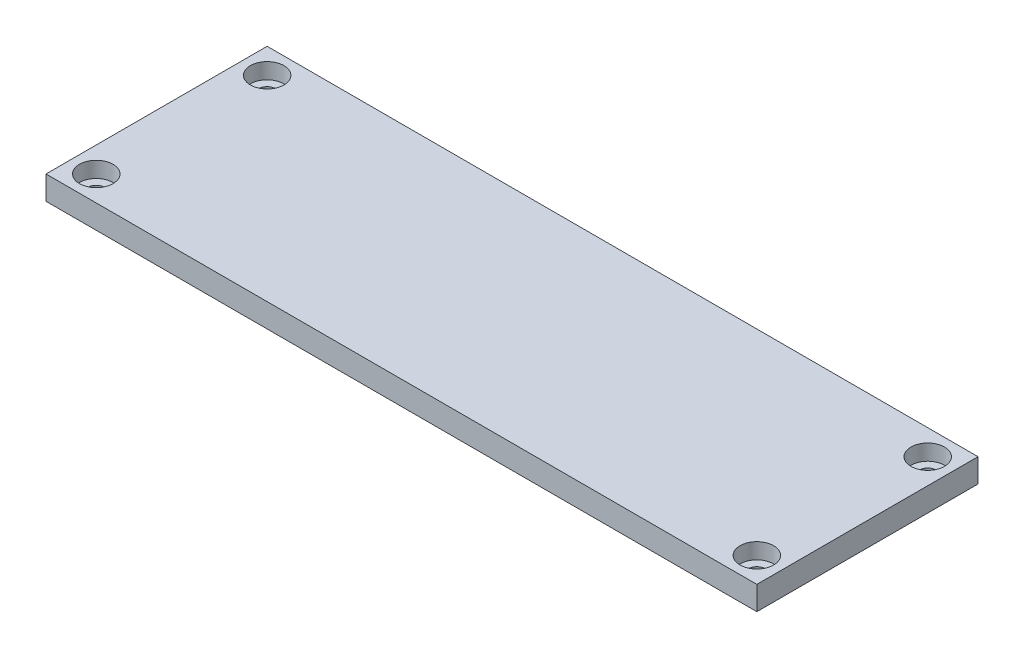
from build123d import *

# Parameters (mm, degrees)
SKETCH2_W           = 90
SKETCH2_H           = 28
BOSS_EXTRUDE1_DEPTH = 3
SKETCH3_R           = 2.125
SKETCH3_R_2         = 1.075
CUT_EXTRUDE1_DEPTH  = 2
SKETCH5_R           = 1.075
CUT_EXTRUDE3_DEPTH  = 4


with BuildPart() as part:
    # Sketch2 → Boss-Extrude1 (new body)
    with BuildSketch(Plane(origin=(0, 0, 0), x_dir=(1, 0, 0), z_dir=(0, 1, 0))):
        with Locations((10.225806452, 5.983870968)):
            Rectangle(SKETCH2_W, SKETCH2_H)
    extrude(amount=BOSS_EXTRUDE1_DEPTH)

    # Sketch3 → Cut-Extrude1 (cut)
    # profile 1 of 4: a face of its own
    with BuildSketch(Plane(origin=(0, 3, 0), x_dir=(1, 0, 0), z_dir=(0, 1, 0))):
        with Locations(Location((-31.592213033, 16.801890452, 0), (0, 0, 270))):
            Circle(SKETCH3_R)
        with Locations(Location((-31.592213033, 16.801890452, 0), (0, 0, 270))):
            Circle(SKETCH3_R_2, mode=Mode.SUBTRACT)
    # profile 2 of 4: a face of its own
    with BuildSketch(Plane(origin=(0, 3, 0), x_dir=(1, 0, 0), z_dir=(0, 1, 0))):
        with Locations(Location((-31.592213033, -4.834148517, 0), (0, 0, 90))):
            Circle(SKETCH3_R)
        with Locations(Location((-31.592213033, -4.834148517, 0), (0, 0, 90))):
            Circle(SKETCH3_R_2, mode=Mode.SUBTRACT)
    # profile 3 of 4: a face of its own
    with BuildSketch(Plane(origin=(0, 3, 0), x_dir=(1, 0, 0), z_dir=(0, 1, 0))):
        with Locations(Location((52.043825936, -4.834148517, 0), (0, 0, 270))):
            Circle(SKETCH3_R)
        with Locations(Location((52.043825936, -4.834148517, 0), (0, 0, 270))):
            Circle(SKETCH3_R_2, mode=Mode.SUBTRACT)
    # profile 4 of 4: a face of its own
    with BuildSketch(Plane(origin=(0, 3, 0), x_dir=(1, 0, 0), z_dir=(0, 1, 0))):
        with Locations(Location((52.043825936, 16.801890452, 0), (0, 0, 90))):
            Circle(SKETCH3_R)
        with Locations(Location((52.043825936, 16.801890452, 0), (0, 0, 90))):
            Circle(SKETCH3_R_2, mode=Mode.SUBTRACT)
    extrude(amount=-CUT_EXTRUDE1_DEPTH, mode=Mode.SUBTRACT)

    # Sketch5 → Cut-Extrude3 (cut)
    with BuildSketch(Plane(origin=(0, 3, 0), x_dir=(1, 0, 0), z_dir=(0, 1, 0))):
        with Locations(Location((-31.592213033, 16.801890452, 0), (0, 0, 270))):
            Circle(SKETCH5_R)
        with Locations(Location((-31.592213033, -4.834148517, 0), (0, 0, 90))):
            Circle(SKETCH5_R)
        with Locations(Location((52.043825936, -4.834148517, 0), (0, 0, 270))):
            Circle(SKETCH5_R)
        with Locations(Location((52.043825936, 16.801890452, 0), (0, 0, 90))):
            Circle(SKETCH5_R)
    extrude(amount=-CUT_EXTRUDE3_DEPTH, mode=Mode.SUBTRACT)


solid = part.part
